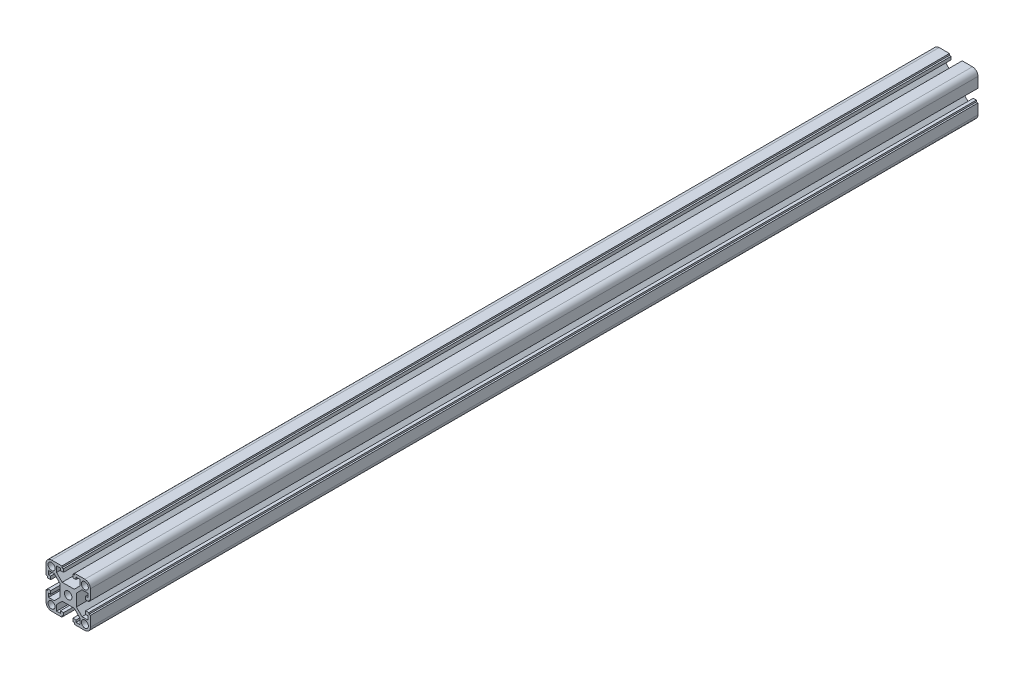
from build123d import *

# Parameters (mm, degrees)
SKETCH_1_R      = 3.4
SKETCH_1_R_2    = 3.15
EXTRUDE_1_DEPTH = 400


with BuildPart() as part:
    # Эскиз1 → Бобышка-Вытянуть1 (new, symmetric)
    with BuildSketch(Plane.XY):
        with BuildLine():
            Line((-15, 20), (-5.727351849, 20))
            Line((-5.727351849, 20), (-5.727351849, 18.530416438))
            Line((-5.727351849, 18.530416438), (-4.25, 18.530416438))
            Line((-4.25, 18.530416438), (-4.25, 15.732027397))
            Line((-4.25, 15.732027397), (-7.111831817, 15.732027397))
            Line((-7.111831817, 15.732027397), (-7.111831817, 17.7))
            Line((-7.111831817, 17.7), (-10.5, 17.7))
            Line((-10.5, 17.7), (-10.5, 12.479898987))
            Line((-10.5, 12.479898987), (-5.420101013, 7.4))
            Line((-5.420101013, 7.4), (5.420101013, 7.4))
            Line((5.420101013, 7.4), (10.5, 12.479898987))
            Line((10.5, 12.479898987), (10.5, 17.7))
            Line((10.5, 17.7), (7.111831817, 17.7))
            Line((7.111831817, 17.7), (7.111831817, 15.732027397))
            Line((7.111831817, 15.732027397), (4.25, 15.732027397))
            Line((4.25, 15.732027397), (4.25, 18.530416438))
            Line((4.25, 18.530416438), (5.727351849, 18.530416438))
            Line((5.727351849, 18.530416438), (5.727351849, 20))
            Line((5.727351849, 20), (15, 20))
            ThreePointArc((15, 20), (18.535533906, 18.535533906), (20, 15))
            Line((20, 15), (20, 5.727351849))
            Line((20, 5.727351849), (18.530416438, 5.727351849))
            Line((18.530416438, 5.727351849), (18.530416438, 4.25))
            Line((18.530416438, 4.25), (15.732027397, 4.25))
            Line((15.732027397, 4.25), (15.732027397, 7.111831817))
            Line((15.732027397, 7.111831817), (17.7, 7.111831817))
            Line((17.7, 7.111831817), (17.7, 10.5))
            Line((17.7, 10.5), (12.479898987, 10.5))
            Line((12.479898987, 10.5), (7.4, 5.420101013))
            Line((7.4, 5.420101013), (7.4, -5.420101013))
            Line((7.4, -5.420101013), (12.479898987, -10.5))
            Line((12.479898987, -10.5), (17.7, -10.5))
            Line((17.7, -10.5), (17.7, -7.111831817))
            Line((17.7, -7.111831817), (15.732027397, -7.111831817))
            Line((15.732027397, -7.111831817), (15.732027397, -4.25))
            Line((15.732027397, -4.25), (18.530416438, -4.25))
            Line((18.530416438, -4.25), (18.530416438, -5.727351849))
            Line((18.530416438, -5.727351849), (20, -5.727351849))
            Line((20, -5.727351849), (20, -15))
            ThreePointArc((20, -15), (18.535533906, -18.535533906), (15, -20))
            Line((15, -20), (5.727351849, -20))
            Line((5.727351849, -20), (5.727351849, -18.530416438))
            Line((5.727351849, -18.530416438), (4.25, -18.530416438))
            Line((4.25, -18.530416438), (4.25, -15.732027397))
            Line((4.25, -15.732027397), (7.111831817, -15.732027397))
            Line((7.111831817, -15.732027397), (7.111831817, -17.7))
            Line((7.111831817, -17.7), (10.5, -17.7))
            Line((10.5, -17.7), (10.5, -12.479898987))
            Line((10.5, -12.479898987), (5.420101013, -7.4))
            Line((5.420101013, -7.4), (-5.420101013, -7.4))
            Line((-5.420101013, -7.4), (-10.5, -12.479898987))
            Line((-10.5, -12.479898987), (-10.5, -17.7))
            Line((-10.5, -17.7), (-7.111831817, -17.7))
            Line((-7.111831817, -17.7), (-7.111831817, -15.732027397))
            Line((-7.111831817, -15.732027397), (-4.25, -15.732027397))
            Line((-4.25, -15.732027397), (-4.25, -18.530416438))
            Line((-4.25, -18.530416438), (-5.727351849, -18.530416438))
            Line((-5.727351849, -18.530416438), (-5.727351849, -20))
            Line((-5.727351849, -20), (-15, -20))
            ThreePointArc((-15, -20), (-18.535533906, -18.535533906), (-20, -15))
            Line((-20, -15), (-20, -5.727351849))
            Line((-20, -5.727351849), (-18.530416438, -5.727351849))
            Line((-18.530416438, -5.727351849), (-18.530416438, -4.25))
            Line((-18.530416438, -4.25), (-15.732027397, -4.25))
            Line((-15.732027397, -4.25), (-15.732027397, -7.111831817))
            Line((-15.732027397, -7.111831817), (-17.7, -7.111831817))
            Line((-17.7, -7.111831817), (-17.7, -10.5))
            Line((-17.7, -10.5), (-12.479898987, -10.5))
            Line((-12.479898987, -10.5), (-7.4, -5.420101013))
            Line((-7.4, -5.420101013), (-7.4, 5.420101013))
            Line((-7.4, 5.420101013), (-12.479898987, 10.5))
            Line((-12.479898987, 10.5), (-17.7, 10.5))
            Line((-17.7, 10.5), (-17.7, 7.111831817))
            Line((-17.7, 7.111831817), (-15.732027397, 7.111831817))
            Line((-15.732027397, 7.111831817), (-15.732027397, 4.25))
            Line((-15.732027397, 4.25), (-18.530416438, 4.25))
            Line((-18.530416438, 4.25), (-18.530416438, 5.727351849))
            Line((-18.530416438, 5.727351849), (-20, 5.727351849))
            Line((-20, 5.727351849), (-20, 15))
            ThreePointArc((-20, 15), (-18.535533906, 18.535533906), (-15, 20))
        make_face()
        Circle(SKETCH_1_R, mode=Mode.SUBTRACT)
        with Locations((-15, 15)):
            Circle(SKETCH_1_R_2, mode=Mode.SUBTRACT)
        with Locations((15, 15)):
            Circle(SKETCH_1_R_2, mode=Mode.SUBTRACT)
        with Locations((15, -15)):
            Circle(SKETCH_1_R_2, mode=Mode.SUBTRACT)
        with Locations((-15, -15)):
            Circle(SKETCH_1_R_2, mode=Mode.SUBTRACT)
    extrude(amount=EXTRUDE_1_DEPTH, both=True)


solid = part.part
